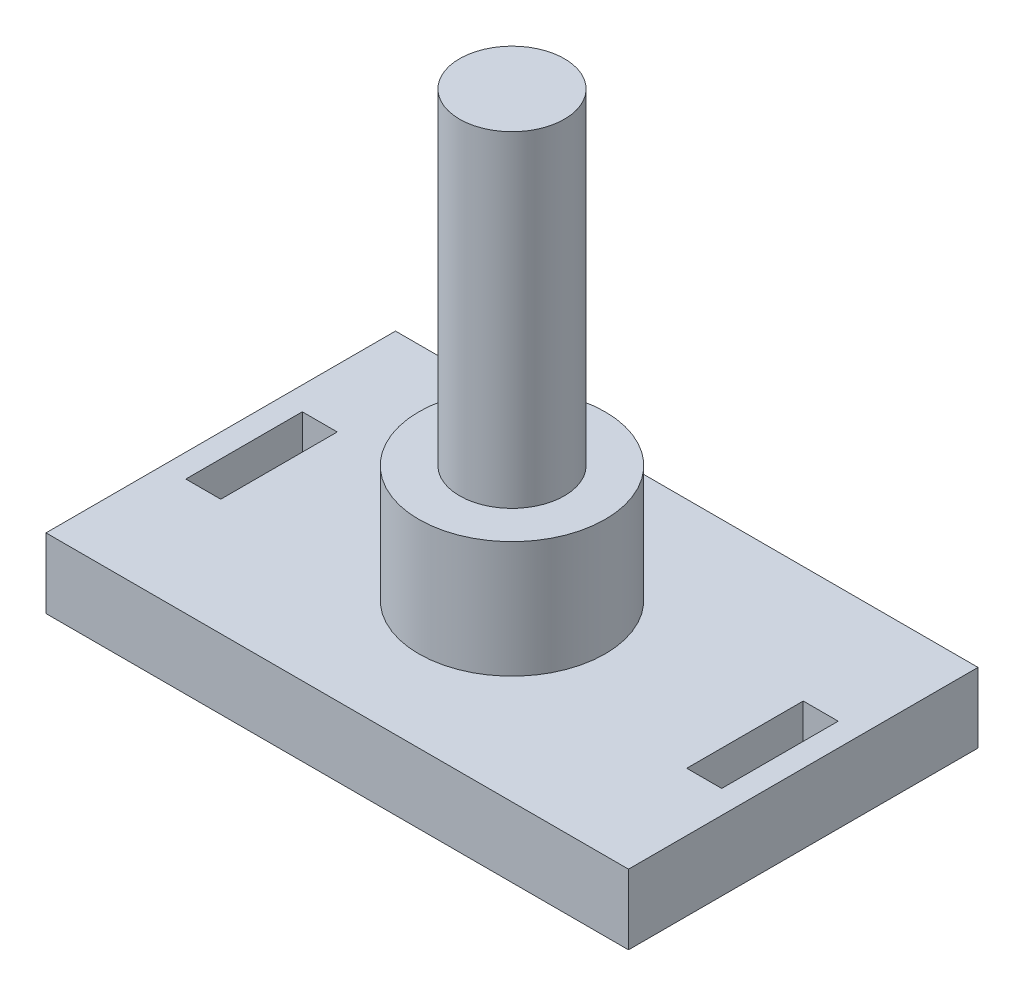
from build123d import *

# Parameters (mm, degrees)
SKETCH1_R           = 2.25
BOSS_EXTRUDE1_DEPTH = 14
SKETCH2_R           = 4
BOSS_EXTRUDE2_DEPTH = 5
SKETCH3_W           = 25
SKETCH3_H           = 15
BOSS_EXTRUDE3_DEPTH = 3
SKETCH4_W           = 1.5
SKETCH4_H           = 5
CUT_EXTRUDE1_DEPTH  = 3


with BuildPart() as part:
    # Sketch1 → Boss-Extrude1 (new body)
    with BuildSketch(Plane(origin=(0, 0, 0), x_dir=(1, 0, 0), z_dir=(0, 1, 0))):
        with Locations(Location((0, 0, 0), (0, 0, 270))):
            Circle(SKETCH1_R)
    extrude(amount=BOSS_EXTRUDE1_DEPTH)

    # Sketch2 → Boss-Extrude2 (add)
    with BuildSketch(Plane.XZ):
        with Locations(Location((0, 0, 0), (0, 0, 270))):
            Circle(SKETCH2_R)
    extrude(amount=BOSS_EXTRUDE2_DEPTH)

    # Sketch3 → Boss-Extrude3 (add)
    with BuildSketch(Plane.XZ.offset(5)):
        Rectangle(SKETCH3_W, SKETCH3_H)
    extrude(amount=BOSS_EXTRUDE3_DEPTH)

    # Sketch4 → Cut-Extrude1 (cut)
    with BuildSketch(Plane.XZ.offset(8)):
        with Locations((-10.75, 0)):
            Rectangle(SKETCH4_W, SKETCH4_H)
        with Locations((10.75, 0)):
            Rectangle(SKETCH4_W, SKETCH4_H)
    extrude(amount=-CUT_EXTRUDE1_DEPTH, mode=Mode.SUBTRACT)


solid = part.part
